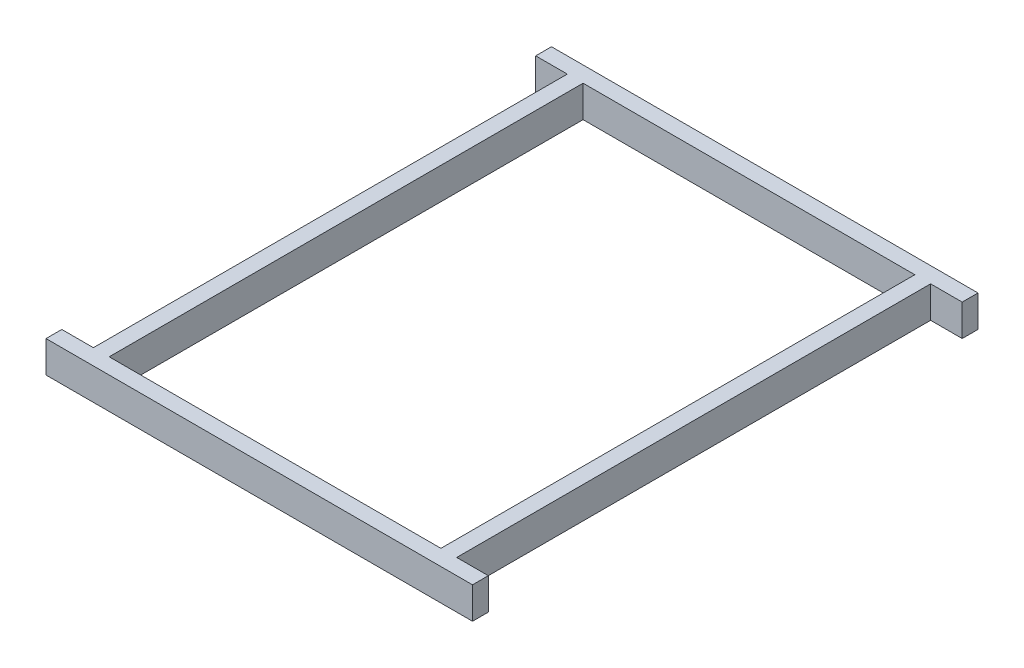
from build123d import *

# Parameters (mm, degrees)
SKETCH1_W           = 533.4
SKETCH1_H           = 762
BOSS_EXTRUDE1_DEPTH = 50.8


with BuildPart() as part:
    # Sketch1 → Boss-Extrude1 (new body)
    with BuildSketch(Plane(origin=(0, 0, 0), x_dir=(1, 0, 0), z_dir=(0, 1, 0))):
        Polygon((-342.9, 0), (342.9, 0), (342.9, 25.4), (292.1, 25.4), (292.1, 787.4), (342.9, 787.4), (342.9, 812.8), (-342.9, 812.8), (-342.9, 787.4), (-292.1, 787.4), (-292.1, 25.4), (-342.9, 25.4), align=None)
        with Locations((0, 406.4)):
            Rectangle(SKETCH1_W, SKETCH1_H, mode=Mode.SUBTRACT)
    extrude(amount=BOSS_EXTRUDE1_DEPTH)


solid = part.part
